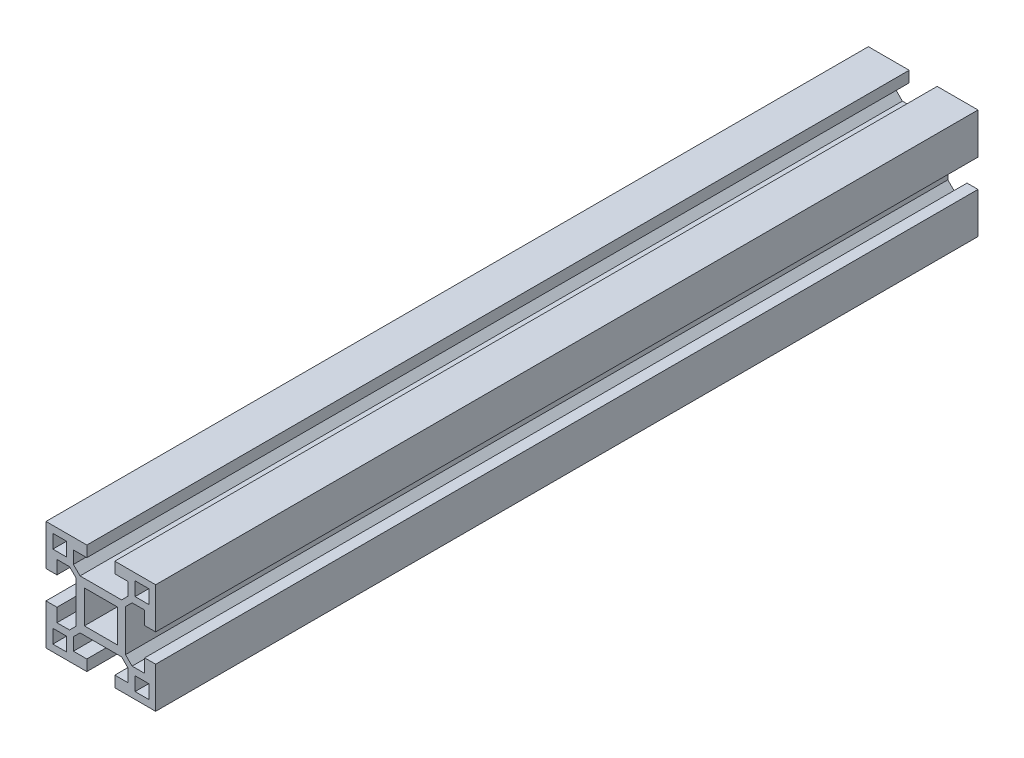
from build123d import *

# Parameters (mm, degrees)
ESQUISSE1_W        = 5
ESQUISSE1_H        = 5
BOSS_EXTRU_1_DEPTH = 300


with BuildPart() as part:
    # Esquisse1 → Boss.-Extru.1 (new body)
    with BuildSketch(Plane.XY):
        Polygon((0, 9), (7.585786438, 9), (10, 11.414213562), (10, 16), (5.1, 16), (5.1, 20), (20, 20), (20, 5.1), (16, 5.1), (16, 10), (11.414213562, 10), (9, 7.585786438), (9, 0), (9, -7.585786438), (11.414213562, -10), (16, -10), (16, -5.1), (20, -5.1), (20, -20), (5.1, -20), (5.1, -16), (10, -16), (10, -11.414213562), (7.585786438, -9), (0, -9), (-7.585786438, -9), (-10, -11.414213562), (-10, -16), (-5.1, -16), (-5.1, -20), (-20, -20), (-20, -5.1), (-16, -5.1), (-16, -10), (-11.414213562, -10), (-9, -7.585786438), (-9, 0), (-9, 7.585786438), (-11.414213562, 10), (-16, 10), (-16, 5.1), (-20, 5.1), (-20, 20), (-5.1, 20), (-5.1, 16), (-10, 16), (-10, 11.414213562), (-7.585786438, 9), align=None)
        with Locations((15, 15)):
            Rectangle(ESQUISSE1_W, ESQUISSE1_H, mode=Mode.SUBTRACT)
        Polygon((0, 6), (6, 6), (6, 0), (6, -6), (0, -6), (-6, -6), (-6, 0), (-6, 6), align=None, mode=Mode.SUBTRACT)
        with Locations((15, -15)):
            Rectangle(ESQUISSE1_W, ESQUISSE1_H, mode=Mode.SUBTRACT)
        with Locations((-15, -15)):
            Rectangle(ESQUISSE1_W, ESQUISSE1_H, mode=Mode.SUBTRACT)
        with Locations((-15, 15)):
            Rectangle(ESQUISSE1_W, ESQUISSE1_H, mode=Mode.SUBTRACT)
    extrude(amount=BOSS_EXTRU_1_DEPTH)


solid = part.part
